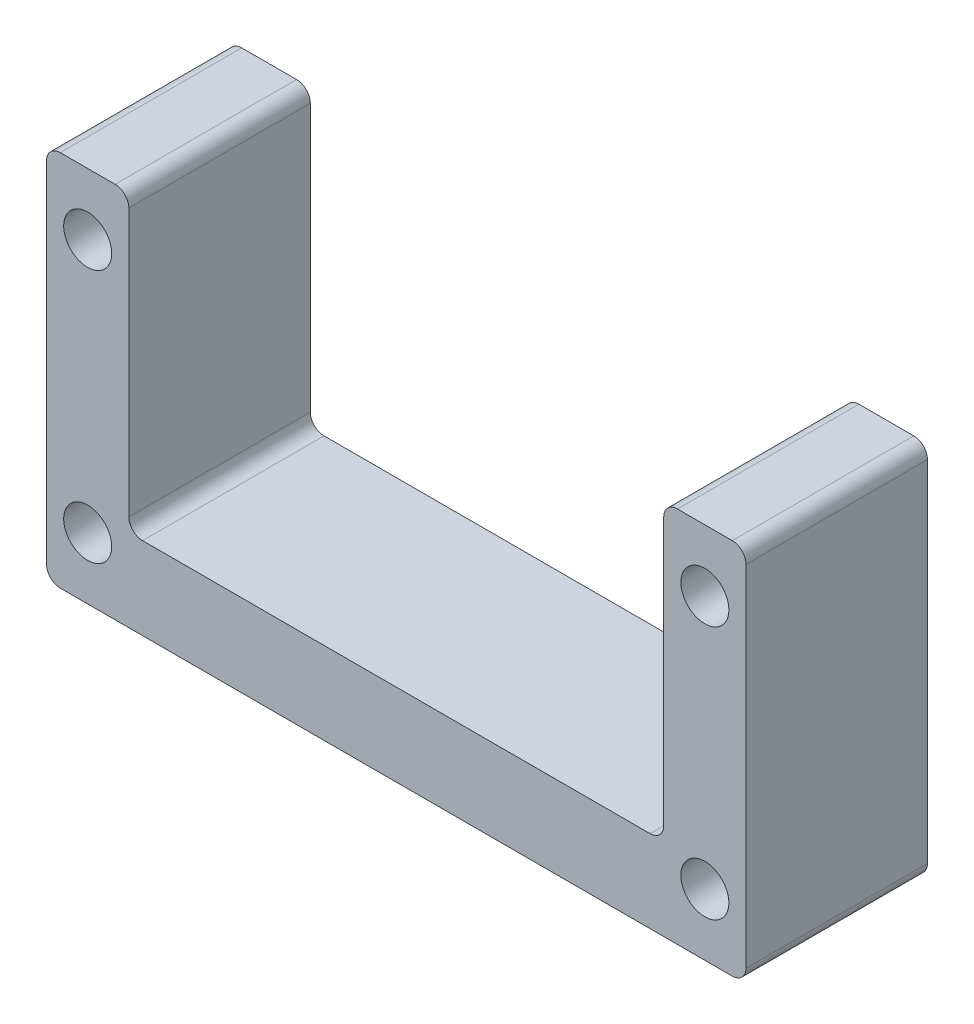
from build123d import *

# Parameters (mm, degrees)
EXTRUDE_1_DEPTH     = 13.23
SKETCH_3_R          = 1.75
CUT_EXTRUDE_2_DEPTH = 32.848789616
FILLET_1_R          = 1


with BuildPart() as part:
    # 草图1 → 凸台-拉伸1 (new body)
    with BuildSketch(Plane.XY):
        Polygon((-19.5, 13.75), (-19.5, -7.75), (19.5, -7.75), (19.5, 13.75), (25.5, 13.75), (25.5, -13.75), (-25.5, -13.75), (-25.5, 13.75), align=None)
    extrude(amount=EXTRUDE_1_DEPTH)

    # 草图3 → 切除-拉伸2 (cut, through all)
    with BuildSketch(Plane.XY.offset(13.23)):
        with Locations((-22.5, 9.25)):
            Circle(SKETCH_3_R)
        with Locations((-22.5, -9.25)):
            Circle(SKETCH_3_R)
        with Locations((22.5, -9.25)):
            Circle(SKETCH_3_R)
        with Locations((22.5, 9.25)):
            Circle(SKETCH_3_R)
    extrude(amount=-CUT_EXTRUDE_2_DEPTH, mode=Mode.SUBTRACT)

    # 圆角1
    fillet_1_edges = [part.edges().sort_by_distance(p)[0] for p in [
        (25.5, -13.75, 6.615),
        (-25.5, -13.75, 6.615),
        (-25.5, 13.75, 6.615),
        (-19.5, 13.75, 6.615),
        (-19.5, -7.75, 6.615),
        (19.5, -7.75, 6.615),
        (19.5, 13.75, 6.615),
        (25.5, 13.75, 6.615),
    ]]
    fillet(fillet_1_edges, radius=FILLET_1_R)


solid = part.part
